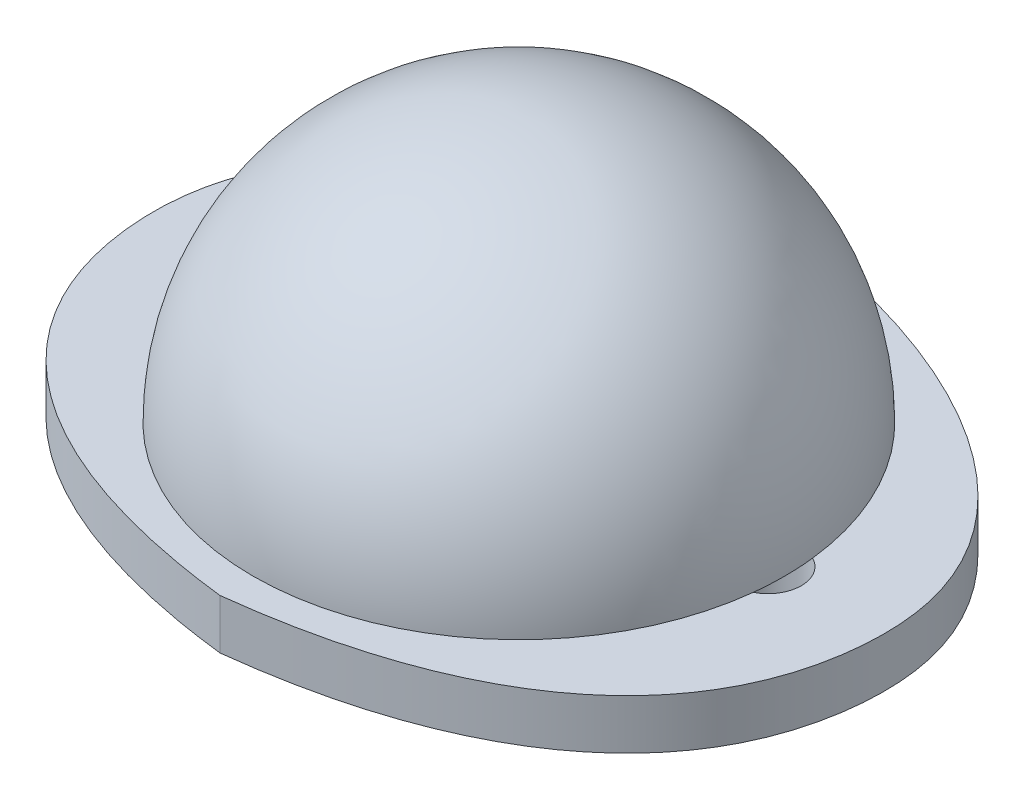
from build123d import *

# Parameters (mm, degrees)
SKETCH_3_R          = 10
EXTRUDE_1_DEPTH     = 3
SKETCH_5_R          = 2
CUT_EXTRUDE_1_DEPTH = 3


with BuildPart() as part:
    # 草圖3 → 填料-伸長1 (new body)
    with BuildSketch(Plane(origin=(0, 0, 0), x_dir=(1, 0, 0), z_dir=(0, 1, 0))):
        with BuildLine():
            add(Edge.make_bspline(
                [(0, 18), (-10.982009899, 16.1458907), (-22.248773715, 9.401529612), (-21.913780718, -9.858427216), (-12.856442382, -16.504271701), (0, -18)],
                knots=[0, 0, 0, 0, 0.441059859, 0.541059859, 1, 1, 1, 1], degree=3))
            add(Edge.make_bspline(
                [(0, 18), (10.982009899, 16.1458907), (22.248773715, 9.401529612), (21.913780718, -9.858427216), (12.856442382, -16.504271701), (0, -18)],
                knots=[0, 0, 0, 0, 0.441059859, 0.541059859, 1, 1, 1, 1], degree=3))
        make_face()
        with Locations(Location((0, 0, 0), (0, 0, 270))):
            Circle(SKETCH_3_R, mode=Mode.SUBTRACT)
    extrude(amount=EXTRUDE_1_DEPTH)

    # 草圖4 → 旋轉1 (revolve)
    with BuildSketch(Plane.XY):
        with BuildLine():
            Line((0, 3), (16, 3))
            ThreePointArc((16, 3), (11.313708499, 14.313708499), (0, 19))
            Line((0, 19), (0, 3))
        make_face()
    revolve(axis=Axis((0, 3, 0), (0, 1, 0)))

    # 草圖5 → 除料-伸長1 (cut)
    with BuildSketch(Plane.XZ):
        with Locations(Location((-15, 0, 0), (0, 0, 270))):
            Circle(SKETCH_5_R)
        with Locations(Location((15, 0, 0), (0, 0, 270))):
            Circle(SKETCH_5_R)
    extrude(amount=-CUT_EXTRUDE_1_DEPTH, mode=Mode.SUBTRACT)


solid = part.part
